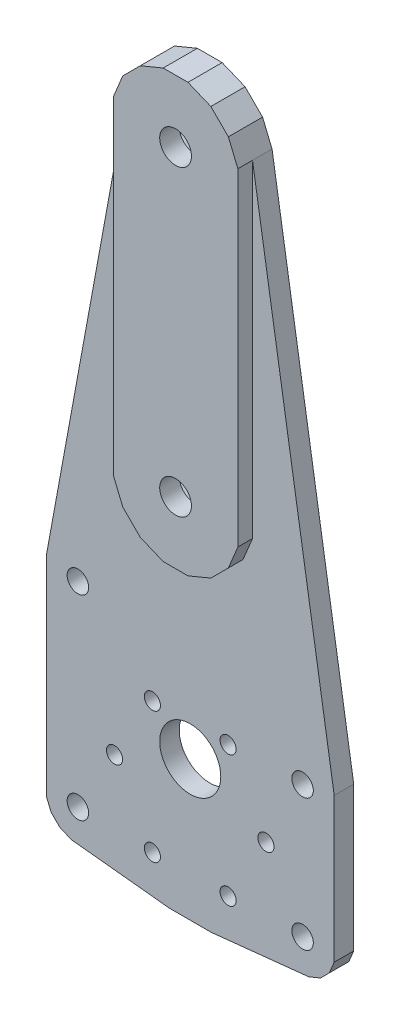
from build123d import *

# Parameters (mm, degrees)
PROFILE_1_R         = 3.25
PROFILE_1_R_2       = 6.25
PROFILE_1_R_3       = 1.65
PROFILE_1_R_4       = 2.2
WHEEL_CARRIER_DEPTH = 4
PIVOT_LANDS_START   = 4
PROFILE_2_R         = 3.25
PIVOT_LANDS_DEPTH   = 3
NUT_SEATS_C_D_START = -0.01
NUT_SEATS_C_D_DEPTH = 3.01


with BuildPart() as part:
    # Profile_1 → Wheel_carrier (new body)
    with BuildSketch(Plane.XY):
        Polygon((10.80910496, 7.222413029), (7.222413029, 10.80910496), (2.536174186, 12.750208645), (-2.536174186, 12.750208645), (-7.222413029, 10.80910496), (-10.80910496, 7.222413029), (-12.750208645, 2.536174186), (-29.473182851, -88.712403875), (-29.473182851, -131.287596125), (-28.487699441, -133.666763538), (-26.666763538, -135.487699441), (-24.287596125, -136.473182851), (-4.291987084, -138.577276169), (4.291987084, -138.577276169), (24.287596125, -136.473182851), (26.666763538, -135.487699441), (28.487699441, -133.666763538), (29.473182851, -131.287596125), (29.473182851, -101.712403875), (12.750208645, 2.536174186), align=None)
        Circle(PROFILE_1_R, mode=Mode.SUBTRACT)
        with Locations((0, -62)):
            Circle(PROFILE_1_R, mode=Mode.SUBTRACT)
        with Locations((0, -110)):
            Circle(PROFILE_1_R_2, mode=Mode.SUBTRACT)
        with Locations((-15.5, -117)):
            Circle(PROFILE_1_R_3, mode=Mode.SUBTRACT)
        with Locations((-7.75, -103.576606241)):
            Circle(PROFILE_1_R_3, mode=Mode.SUBTRACT)
        with Locations((7.75, -103.576606241)):
            Circle(PROFILE_1_R_3, mode=Mode.SUBTRACT)
        with Locations((15.5, -117)):
            Circle(PROFILE_1_R_3, mode=Mode.SUBTRACT)
        with Locations((7.75, -130.423393759)):
            Circle(PROFILE_1_R_3, mode=Mode.SUBTRACT)
        with Locations((-7.75, -130.423393759)):
            Circle(PROFILE_1_R_3, mode=Mode.SUBTRACT)
        with Locations((23, -130)):
            Circle(PROFILE_1_R_4, mode=Mode.SUBTRACT)
        with Locations((-23, -130)):
            Circle(PROFILE_1_R_4, mode=Mode.SUBTRACT)
        with Locations((23, -103)):
            Circle(PROFILE_1_R_4, mode=Mode.SUBTRACT)
        with Locations((-23, -90)):
            Circle(PROFILE_1_R_4, mode=Mode.SUBTRACT)
    extrude(amount=WHEEL_CARRIER_DEPTH)

    # Profile_2 → Pivot_lands (add)
    with BuildSketch(Plane.XY.offset(PIVOT_LANDS_START)):
        Polygon((-10.80910496, -69.222413029), (-7.222413029, -72.80910496), (-2.536174186, -74.750208645), (2.536174186, -74.750208645), (7.222413029, -72.80910496), (10.80910496, -69.222413029), (12.750208645, -64.536174186), (12.750208645, 2.536174186), (10.80910496, 7.222413029), (7.222413029, 10.80910496), (2.536174186, 12.750208645), (-2.536174186, 12.750208645), (-7.222413029, 10.80910496), (-10.80910496, 7.222413029), (-12.750208645, 2.536174186), (-12.750208645, -64.536174186), align=None)
        Circle(PROFILE_2_R, mode=Mode.SUBTRACT)
        with Locations((0, -62)):
            Circle(PROFILE_2_R, mode=Mode.SUBTRACT)
    extrude(amount=PIVOT_LANDS_DEPTH)

    # Profile_3 → Nut_seats_C_D (cut)
    with BuildSketch(Plane.XY.offset(NUT_SEATS_C_D_START)):
        Polygon((-5.175, -2.987787643), (0, -5.975575286), (5.175, -2.987787643), (5.175, 2.987787643), (0, 5.975575286), (-5.175, 2.987787643), align=None)
        Polygon((-5.175, -64.987787643), (0, -67.975575286), (5.175, -64.987787643), (5.175, -59.012212357), (0, -56.024424714), (-5.175, -59.012212357), align=None)
    extrude(amount=NUT_SEATS_C_D_DEPTH, mode=Mode.SUBTRACT)


solid = part.part
